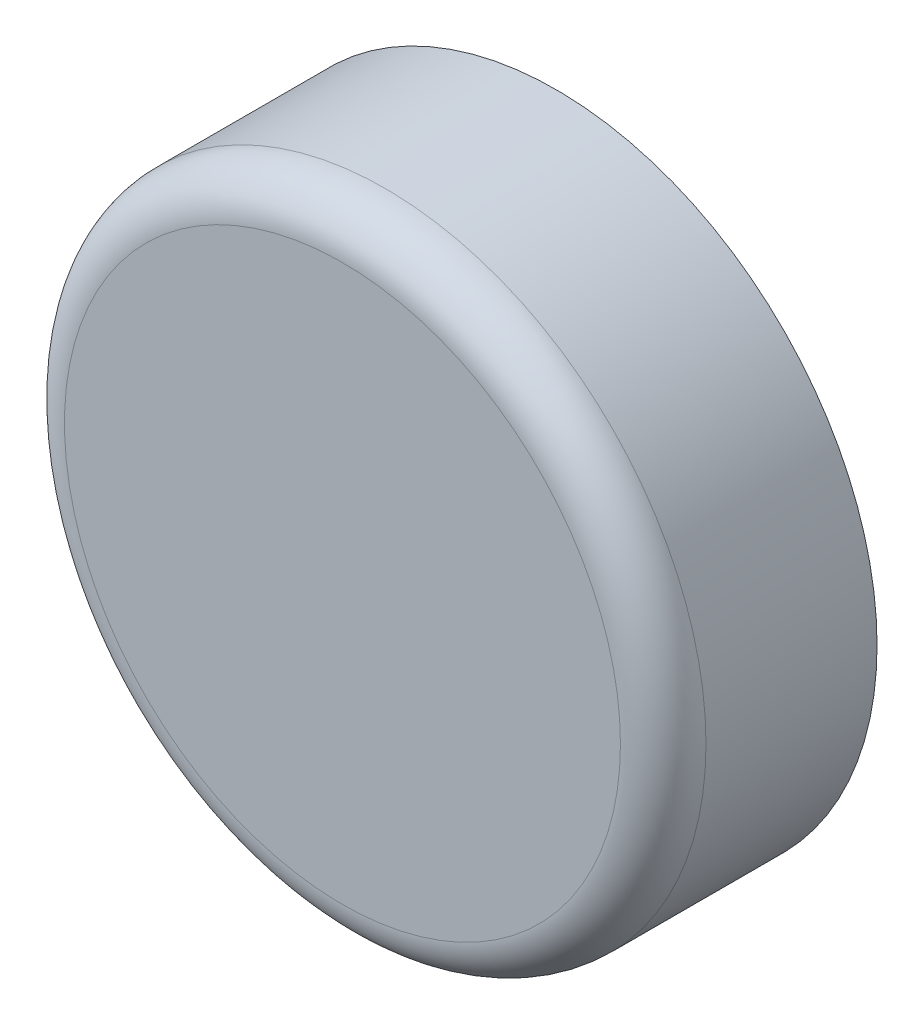
from build123d import *

# Parameters (mm, degrees)
SKIZZE1_R                       = 15
AUFSATZ_LINEAR_AUSTRAGEN1_DEPTH = 10
VERRUNDUNG1_R                   = 2


with BuildPart() as part:
    # Skizze1 → Aufsatz-Linear austragen1 (new body)
    with BuildSketch(Plane.XY):
        Circle(SKIZZE1_R)
    extrude(amount=AUFSATZ_LINEAR_AUSTRAGEN1_DEPTH)

    # Verrundung1
    verrundung1_edges = [part.edges().sort_by_distance(p)[0] for p in [
        (-15, 0, 10),
    ]]
    fillet(verrundung1_edges, radius=VERRUNDUNG1_R)


solid = part.part
